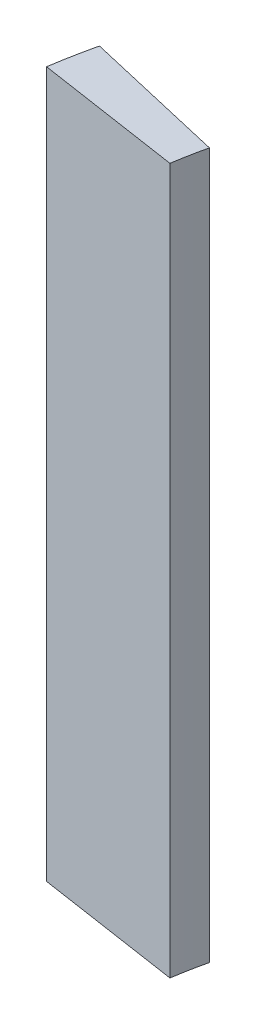
from build123d import *

# Parameters (mm, degrees)
BOSS_EXTRUDE1_DEPTH = 48


with BuildPart() as part:
    # Sketch1 → Boss-Extrude1 (new body)
    with BuildSketch(Plane(origin=(0, 0, 0), x_dir=(1, 0, 0), z_dir=(0, 1, 0))):
        with BuildLine():
            ThreePointArc((-4.574388162, 2.292912484), (-4.892801235, 0.787572143), (-5.152379072, -0.729021334))
            Line((-5.152379072, -0.729021334), (4.735385499, -2.223047022))
            ThreePointArc((4.735385499, -2.223047022), (4.929234761, -1.090620905), (5.16699914, 0.033405138))
            Line((5.16699914, 0.033405138), (-4.574388162, 2.292912484))
        make_face()
    extrude(amount=BOSS_EXTRUDE1_DEPTH)


solid = part.part
